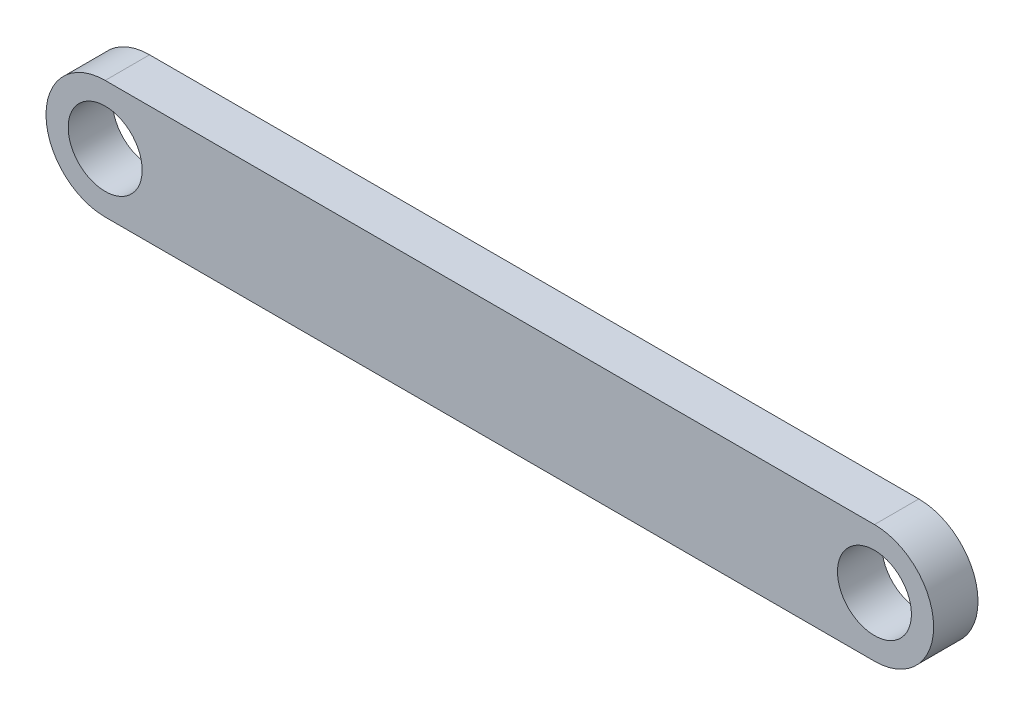
from build123d import *

# Parameters (mm, degrees)
SKETCH2_R           = 2.5
BOSS_EXTRUDE1_DEPTH = 3


with BuildPart() as part:
    # Sketch2 → Boss-Extrude1 (new body)
    with BuildSketch(Plane.XY):
        with BuildLine():
            Line((-52, 4), (0, 4))
            ThreePointArc((0, 4), (4, 0), (0, -4))
            Line((0, -4), (-52, -4))
            ThreePointArc((-52, -4), (-56, 0), (-52, 4))
        make_face()
        with Locations((-52, 0)):
            Circle(SKETCH2_R, mode=Mode.SUBTRACT)
        Circle(SKETCH2_R, mode=Mode.SUBTRACT)
    extrude(amount=BOSS_EXTRUDE1_DEPTH)


solid = part.part
